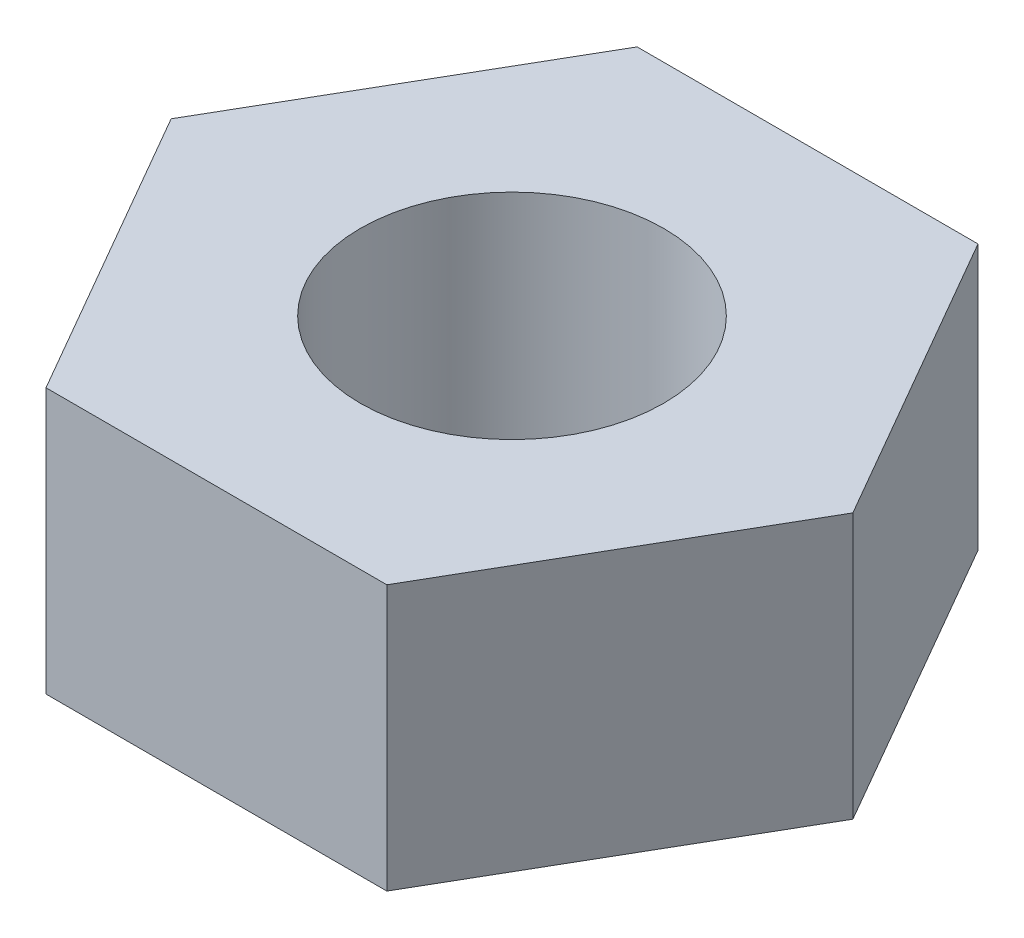
from build123d import *

# Parameters (mm, degrees)
SKETCH_1_R      = 8
EXTRUDE_1_DEPTH = 14


with BuildPart() as part:
    # Эскиз1 → Вытянуть1 (new body)
    with BuildSketch(Plane(origin=(0, 0, 0), x_dir=(1, 0, 0), z_dir=(0, 1, 0))):
        Polygon((8.990253087, -15.594080589), (17.999996483, -0.011252735), (9.009743395, 15.582827855), (-8.990253087, 15.594080589), (-17.999996483, 0.011252735), (-9.009743395, -15.582827855), align=None)
        with Locations(Location((0, 0, 0), (0, 0, 270))):
            Circle(SKETCH_1_R, mode=Mode.SUBTRACT)
    extrude(amount=EXTRUDE_1_DEPTH)


solid = part.part
